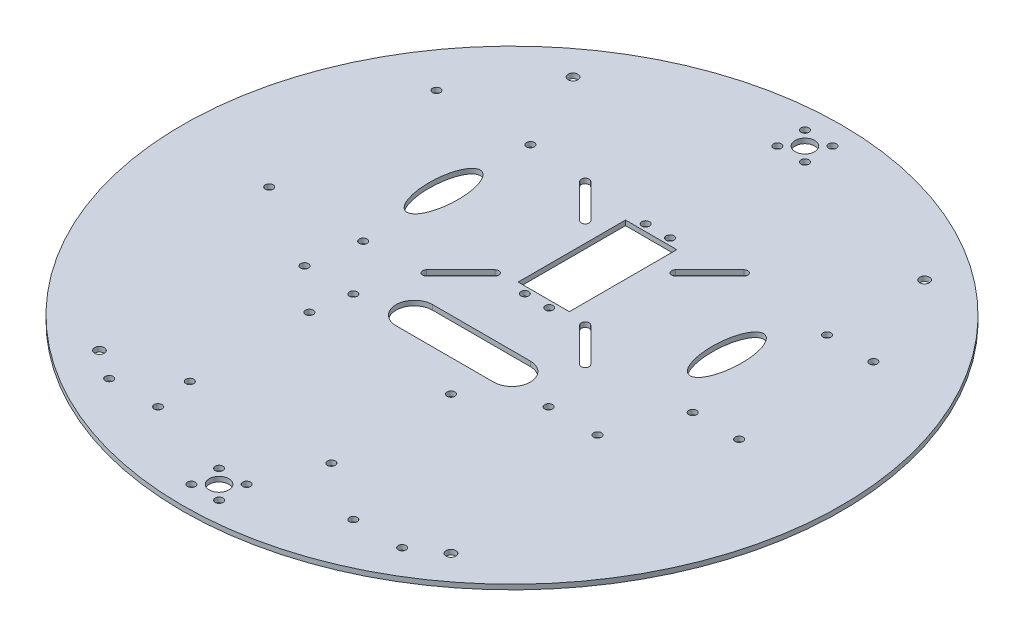
from build123d import *

# Parameters (mm, degrees)
SKETCH_1_R          = 135
EXTRUDE_1_DEPTH     = 2
SKETCH_562_R        = 1.6
SKETCH_562_W        = 21
SKETCH_562_H        = 44
CUT_EXTRUDE_1_DEPTH = 10
SKETCH_1031_R       = 1.6
CUT_EXTRUDE_2_DEPTH = 10
SKETCH_4_R          = 2
SKETCH_4_R_2        = 4
SKETCH_4_R_3        = 1.6
CUT_EXTRUDE_3_DEPTH = 10
CUT_EXTRUDE_4_DEPTH = 10
SKETCH_6_R          = 1.6
CUT_EXTRUDE_7_DEPTH = 10


with BuildPart() as part:
    # 草图1 → 凸台-拉伸1 (new body)
    with BuildSketch(Plane(origin=(0, 0, 0), x_dir=(1, 0, 0), z_dir=(0, 1, 0))):
        with Locations(Location((0, 0, 0), (0, 0, 270))):
            Circle(SKETCH_1_R)
    extrude(amount=EXTRUDE_1_DEPTH)

    # Sketch 562 → 切除-拉伸1 (cut)
    with BuildSketch(Plane(origin=(0, 2, 0), x_dir=(1, 0, 0), z_dir=(0, 1, 0))):
        with Locations(Location((-5, 59.75, 0), (0, 0, 270))):
            Circle(SKETCH_562_R)
        with Locations(Location((5, 59.75, 0), (0, 0, 270))):
            Circle(SKETCH_562_R)
        with Locations(Location((-5, 10.25, 0), (0, 0, 270))):
            Circle(SKETCH_562_R)
        with Locations(Location((5, 10.25, 0), (0, 0, 270))):
            Circle(SKETCH_562_R)
        with Locations(Location((18.5, 48.5, 0), (0, 0, 270))):
            Circle(SKETCH_562_R)
        with Locations(Location((18.5, 11.5, 0), (0, 0, 270))):
            Circle(SKETCH_562_R)
        with Locations(Location((-18.5, 11.5, 0), (0, 0, 270))):
            Circle(SKETCH_562_R)
        with Locations(Location((-18.5, 48.5, 0), (0, 0, 270))):
            Circle(SKETCH_562_R)
        with Locations((0, 35)):
            Rectangle(SKETCH_562_W, SKETCH_562_H)
    extrude(amount=-CUT_EXTRUDE_1_DEPTH, mode=Mode.SUBTRACT)

    # Sketch 1031 → 切除-拉伸2 (cut)
    with BuildSketch(Plane(origin=(0, 2, 0), x_dir=(1, 0, 0), z_dir=(0, 1, 0))):
        with Locations(Location((-60, -25, 0), (0, 0, 270))):
            Circle(SKETCH_1031_R)
        with Locations(Location((-40, -25, 0), (0, 0, 270))):
            Circle(SKETCH_1031_R)
        with Locations(Location((40, -25, 0), (0, 0, 270))):
            Circle(SKETCH_1031_R)
        with Locations(Location((60, -25, 0), (0, 0, 270))):
            Circle(SKETCH_1031_R)
        with Locations(Location((60, -105, 0), (0, 0, 270))):
            Circle(SKETCH_1031_R)
        with Locations(Location((40, -105, 0), (0, 0, 270))):
            Circle(SKETCH_1031_R)
        with Locations(Location((-40, -105, 0), (0, 0, 270))):
            Circle(SKETCH_1031_R)
        with Locations(Location((-60, -105, 0), (0, 0, 270))):
            Circle(SKETCH_1031_R)
        with Locations(Location((-42.5, -89.5, 0), (0, 0, 270))):
            Circle(SKETCH_1031_R)
        with Locations(Location((-42.5, -40.5, 0), (0, 0, 270))):
            Circle(SKETCH_1031_R)
        with Locations(Location((15.5, -40.5, 0), (0, 0, 270))):
            Circle(SKETCH_1031_R)
        with Locations(Location((15.5, -89.5, 0), (0, 0, 270))):
            Circle(SKETCH_1031_R)
    extrude(amount=-CUT_EXTRUDE_2_DEPTH, mode=Mode.SUBTRACT)

    # 草图4 → 切除-拉伸3 (cut)
    with BuildSketch(Plane(origin=(0, 2, 0), x_dir=(1, 0, 0), z_dir=(0, 1, 0))):
        with Locations(Location((-72, 97, 0), (0, 0, 270))):
            Circle(SKETCH_4_R)
        with Locations(Location((72, 97, 0), (0, 0, 270))):
            Circle(SKETCH_4_R)
        with Locations(Location((72, -97, 0), (0, 0, 270))):
            Circle(SKETCH_4_R)
        with Locations(Location((-72, -97, 0), (0, 0, 270))):
            Circle(SKETCH_4_R)
        with Locations(Location((0, -120, 0), (0, 0, 270))):
            Circle(SKETCH_4_R_2)
        with Locations(Location((-5.656854249, -125.656854249, 0), (0, 0, 270))):
            Circle(SKETCH_4_R_3)
        with Locations(Location((-5.656854249, -114.343145751, 0), (0, 0, 270))):
            Circle(SKETCH_4_R_3)
        with Locations(Location((5.656854249, -114.343145751, 0), (0, 0, 270))):
            Circle(SKETCH_4_R_3)
        with Locations(Location((5.656854249, -125.656854249, 0), (0, 0, 270))):
            Circle(SKETCH_4_R_3)
        with Locations(Location((5.656854249, 125.656854249, 0), (0, 0, 270))):
            Circle(SKETCH_4_R_3)
        with Locations(Location((5.656854249, 114.343145751, 0), (0, 0, 270))):
            Circle(SKETCH_4_R_3)
        with Locations(Location((-5.656854249, 114.343145751, 0), (0, 0, 270))):
            Circle(SKETCH_4_R_3)
        with Locations(Location((-5.656854249, 125.656854249, 0), (0, 0, 270))):
            Circle(SKETCH_4_R_3)
        with Locations(Location((0, 120, 0), (0, 0, 270))):
            Circle(SKETCH_4_R_2)
        with BuildLine():
            Line((-20, -12.5), (20, -12.5))
            ThreePointArc((20, -12.5), (27.5, -20), (20, -27.5))
            Line((20, -27.5), (-20, -27.5))
            ThreePointArc((-20, -27.5), (-27.5, -20), (-20, -12.5))
        make_face()
    extrude(amount=-CUT_EXTRUDE_3_DEPTH, mode=Mode.SUBTRACT)

    # 草图5 → 切除-拉伸4 (cut)
    with BuildSketch(Plane(origin=(0, 2, 0), x_dir=(1, 0, 0), z_dir=(0, 1, 0))):
        with BuildLine():
            Line((-31.36862915, 63.63137085), (-17.36862915, 49.63137085))
            ThreePointArc((-17.36862915, 49.63137085), (-17.36862915, 47.36862915), (-19.63137085, 47.36862915))
            Line((-19.63137085, 47.36862915), (-33.63137085, 61.36862915))
            ThreePointArc((-33.63137085, 61.36862915), (-33.63137085, 63.63137085), (-31.36862915, 63.63137085))
        make_face()
        with BuildLine():
            Line((33.63137085, 61.36862915), (19.63137085, 47.36862915))
            ThreePointArc((19.63137085, 47.36862915), (17.36862915, 47.36862915), (17.36862915, 49.63137085))
            Line((17.36862915, 49.63137085), (31.36862915, 63.63137085))
            ThreePointArc((31.36862915, 63.63137085), (33.63137085, 63.63137085), (33.63137085, 61.36862915))
        make_face()
        with BuildLine():
            Line((31.36862915, -3.63137085), (17.36862915, 10.36862915))
            ThreePointArc((17.36862915, 10.36862915), (17.36862915, 12.63137085), (19.63137085, 12.63137085))
            Line((19.63137085, 12.63137085), (33.63137085, -1.36862915))
            ThreePointArc((33.63137085, -1.36862915), (33.63137085, -3.63137085), (31.36862915, -3.63137085))
        make_face()
        with BuildLine():
            Line((-33.63137085, -1.36862915), (-19.63137085, 12.63137085))
            ThreePointArc((-19.63137085, 12.63137085), (-17.36862915, 12.63137085), (-17.36862915, 10.36862915))
            Line((-17.36862915, 10.36862915), (-31.36862915, -3.63137085))
            ThreePointArc((-31.36862915, -3.63137085), (-33.63137085, -3.63137085), (-33.63137085, -1.36862915))
        make_face()
    extrude(amount=-CUT_EXTRUDE_4_DEPTH, mode=Mode.SUBTRACT)

    # 草图6 → 切除-拉伸7 (cut)
    with BuildSketch(Plane(origin=(0, 2, 0), x_dir=(1, 0, 0), z_dir=(0, 1, 0))):
        with Locations(Location((71.537199543, 2.5, 0), (0, 0, 270))):
            Circle(SKETCH_6_R)
        with Locations(Location((90.537199543, 2.5, 0), (0, 0, 270))):
            Circle(SKETCH_6_R)
        with Locations(Location((90.537199543, 57.5, 0), (0, 0, 270))):
            Circle(SKETCH_6_R)
        with Locations(Location((71.537199543, 57.5, 0), (0, 0, 270))):
            Circle(SKETCH_6_R)
        with Locations(Location((-95.215957975, -4.25, 0), (0, 0, 270))):
            Circle(SKETCH_6_R)
        with Locations(Location((-56.715957975, -4.25, 0), (0, 0, 270))):
            Circle(SKETCH_6_R)
        with Locations(Location((-95.215957975, 64.25, 0), (0, 0, 270))):
            Circle(SKETCH_6_R)
        with Locations(Location((-56.715957975, 64.25, 0), (0, 0, 270))):
            Circle(SKETCH_6_R)
        with BuildLine():
            add(Edge.make_bspline(
                [(-58.031053316, 15), (-47.63874847, 15), (-52.834900893, 37.5), (-58.031053316, 60), (-63.227205738, 37.5), (-68.423358161, 15), (-58.031053316, 15)],
                knots=[0, 0, 0, 2.094395102, 2.094395102, 4.188790205, 4.188790205, 6.283185307, 6.283185307, 6.283185307], degree=2, weights=[1, 0.5, 1, 0.5, 1, 0.5, 1]))
        make_face()
        with BuildLine():
            add(Edge.make_bspline(
                [(58.031053316, 45), (47.63874847, 45), (52.834900893, 22.5), (58.031053316, 0), (63.227205738, 22.5), (68.423358161, 45), (58.031053316, 45)],
                knots=[0, 0, 0, 2.094395102, 2.094395102, 4.188790205, 4.188790205, 6.283185307, 6.283185307, 6.283185307], degree=2, weights=[1, 0.5, 1, 0.5, 1, 0.5, 1]))
        make_face()
    extrude(amount=-CUT_EXTRUDE_7_DEPTH, mode=Mode.SUBTRACT)


solid = part.part
